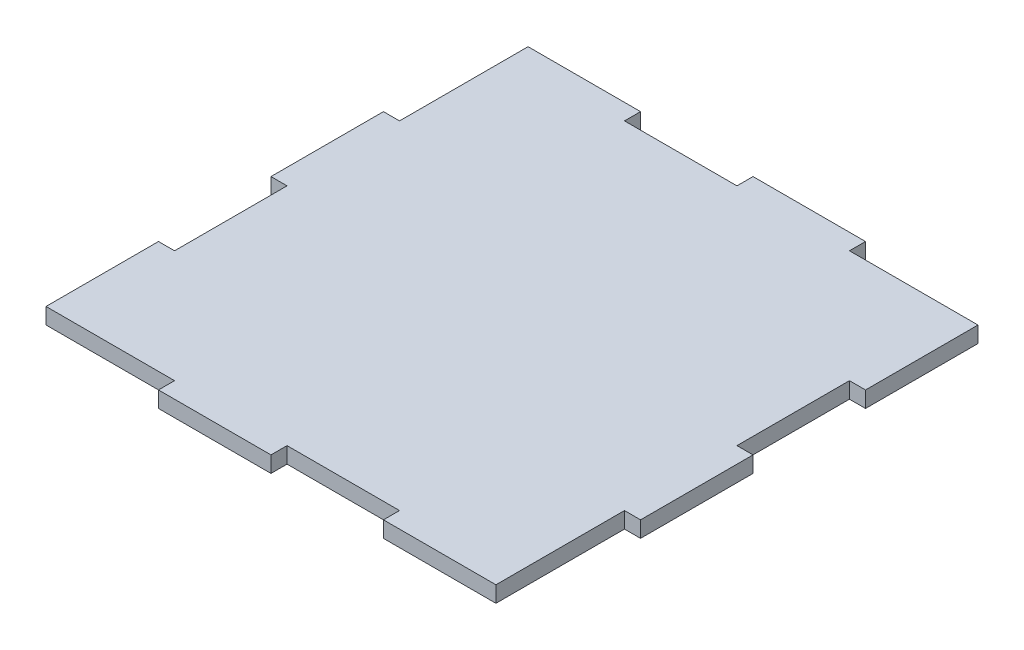
from build123d import *

# Parameters (mm, degrees)
BOSS_EXTRUDE1_DEPTH = 6.35


with BuildPart() as part:
    # Sketch1 → Boss-Extrude1 (new body)
    with BuildSketch(Plane(origin=(0, 0, 0), x_dir=(1, 0, 0), z_dir=(0, 1, 0))):
        Polygon((-118.856214689, -84.487288136), (-68.056214689, -84.487288136), (-68.056214689, -90.837288136), (-23.606214689, -90.837288136), (-23.606214689, -84.487288136), (20.843785311, -84.487288136), (20.843785311, -90.837288136), (65.293785311, -90.837288136), (65.293785311, -40.037288136), (71.643785311, -40.037288136), (71.643785311, 4.412711864), (65.293785311, 4.412711864), (65.293785311, 48.862711864), (71.643785311, 48.862711864), (71.643785311, 93.312711864), (20.843785311, 93.312711864), (20.843785311, 99.662711864), (-23.606214689, 99.662711864), (-23.606214689, 93.312711864), (-68.056214689, 93.312711864), (-68.056214689, 99.662711864), (-112.506214689, 99.662711864), (-112.506214689, 48.862711864), (-118.856214689, 48.862711864), (-118.856214689, 4.412711864), (-112.506214689, 4.412711864), (-112.506214689, -40.037288136), (-118.856214689, -40.037288136), align=None)
    extrude(amount=BOSS_EXTRUDE1_DEPTH)


solid = part.part
